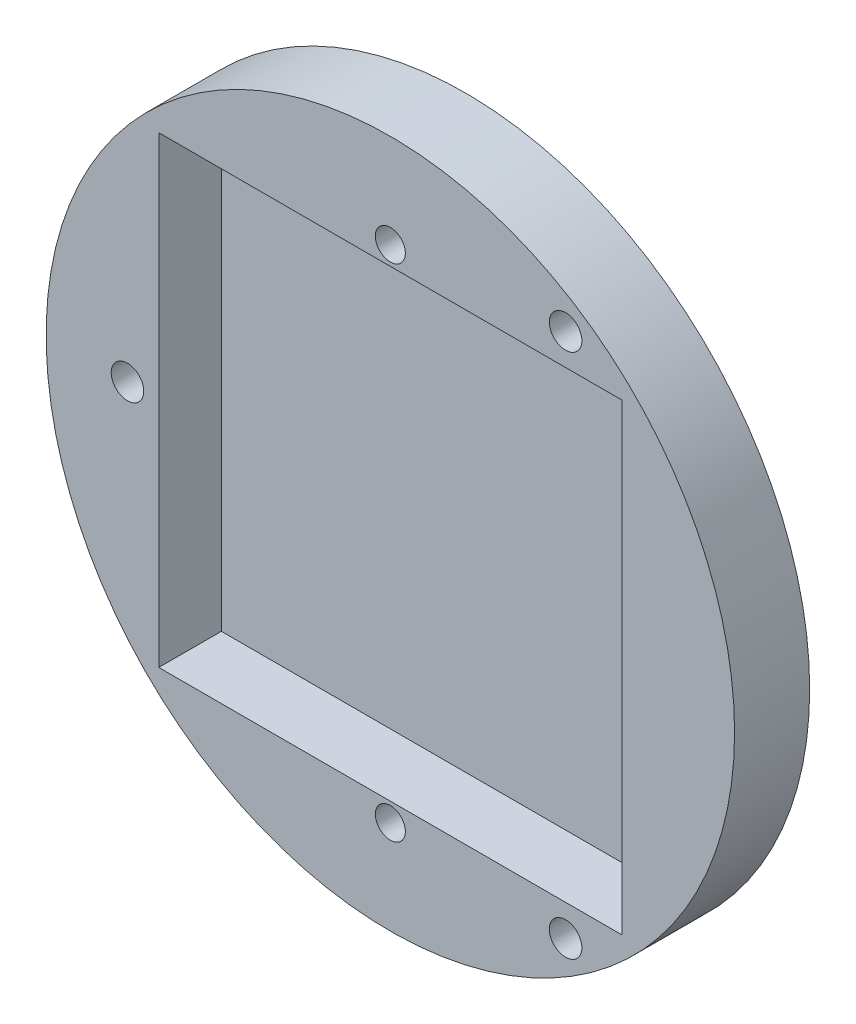
from build123d import *

# Parameters (mm, degrees)
SKETCH1_R            = 27.5
SKETCH1_W            = 37
SKETCH1_H            = 37
BOSS_EXTRUDE1_DEPTH  = 6
SKETCH1_3_W          = 37
SKETCH1_3_H          = 37
BOSS_EXTRUDE2_DEPTH  = 1
M2_CLEARANCE_HOLE1_D = 2.6
M2_CLEARANCE_HOLE2_D = 2.4
CUT_EXTRUDE3_DEPTH   = 0.8


with BuildPart() as part:
    # Sketch1 → Boss-Extrude1 (new body)
    with BuildSketch(Plane.XY):
        Circle(SKETCH1_R)
        Rectangle(SKETCH1_W, SKETCH1_H, mode=Mode.SUBTRACT)
    extrude(amount=BOSS_EXTRUDE1_DEPTH)

    # Sketch1<3> → Boss-Extrude2 (add)
    with BuildSketch(Plane.XY):
        Rectangle(SKETCH1_3_W, SKETCH1_3_H)
    extrude(amount=BOSS_EXTRUDE2_DEPTH)

    # Sketch2 → Revolve1 (revolve)
    with BuildSketch(Plane(origin=(0, 0, 0), x_dir=(1, 0, 0), z_dir=(0, 1, 0))):
        with BuildLine():
            Line((0, 6.5), (0, 0))
            Line((0, 0), (-6.5, 0))
            ThreePointArc((-6.5, 0), (-4.596194078, 4.596194078), (0, 6.5))
        make_face()
    revolve(axis=Axis((0, 0, -15), (0, 0, 1)))

    # M2 Clearance Hole1 (through all)
    with Locations(Plane.XY.offset(6)):
        with Locations((-21, 0), (14, -21), (14, 21)):
            Hole(M2_CLEARANCE_HOLE1_D / 2)

    # M2 Clearance Hole2 (through all)
    with Locations(Plane(origin=(0, 20, 0), x_dir=(-1, 0, 0), z_dir=(0, 0, -1))):
        with Locations((0, 0), (0, -40)):
            Hole(M2_CLEARANCE_HOLE2_D / 2)

    # Sketch5 → Cut-Extrude3 (cut)
    with BuildSketch(Plane.XY):
        Polygon((0, 17.401923789), (2.25, 18.700961894), (2.25, 21.299038106), (0, 22.598076211), (-2.25, 21.299038106), (-2.25, 18.700961894), align=None)
        Polygon((-2.25, -18.700961894), (0, -17.401923789), (2.25, -18.700961894), (2.25, -21.299038106), (0, -22.598076211), (-2.25, -21.299038106), align=None)
    extrude(amount=CUT_EXTRUDE3_DEPTH, mode=Mode.SUBTRACT)


solid = part.part
